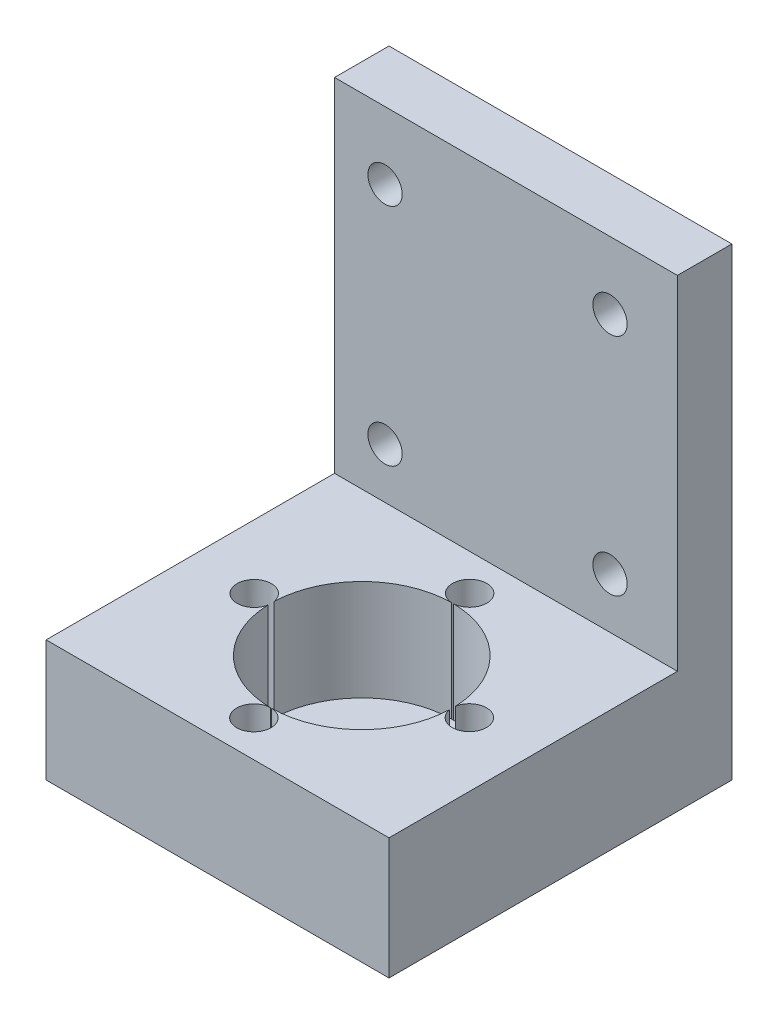
from build123d import *

# Parameters (mm, degrees)
SKETCH1_W           = 34
SKETCH1_H           = 34
BOSS_EXTRUDE1_DEPTH = 12.04
SKETCH2_W           = 34
SKETCH2_H           = 5.4
BOSS_EXTRUDE2_DEPTH = 34
SKETCH3_R           = 9
CUT_EXTRUDE1_DEPTH  = 10
SKETCH4_R           = 1.7
SKETCH4_R_2         = 1.700000029
CUT_EXTRUDE2_DEPTH  = 59.889727457
SKETCH6_R           = 3
CUT_EXTRUDE3_DEPTH  = 66.176682947
SKETCH7_R           = 1.7
CUT_EXTRUDE4_DEPTH  = 64.981572347


with BuildPart() as part:
    # Sketch1 → Boss-Extrude1 (new body)
    with BuildSketch(Plane(origin=(0, 0, 0), x_dir=(1, 0, 0), z_dir=(0, 1, 0))):
        with Locations((17, 17)):
            Rectangle(SKETCH1_W, SKETCH1_H)
    extrude(amount=BOSS_EXTRUDE1_DEPTH)

    # Sketch2 → Boss-Extrude2 (add)
    with BuildSketch(Plane(origin=(0, 12.04, 0), x_dir=(1, 0, 0), z_dir=(0, 1, 0))):
        with Locations((17, 31.3)):
            Rectangle(SKETCH2_W, SKETCH2_H)
    extrude(amount=BOSS_EXTRUDE2_DEPTH)

    # Sketch3 → Cut-Extrude1 (cut)
    with BuildSketch(Plane(origin=(0, 12.04, 0), x_dir=(1, 0, 0), z_dir=(0, 1, 0))):
        with Locations(Location((17, 14.3, 0), (0, 0, 270))):
            Circle(SKETCH3_R)
    extrude(amount=-CUT_EXTRUDE1_DEPTH, mode=Mode.SUBTRACT)

    # Sketch4 → Cut-Extrude2 (cut, through all)
    with BuildSketch(Plane(origin=(0, 12.04, 0), x_dir=(1, 0, 0), z_dir=(0, 1, 0))):
        with Locations(Location((6.33358771, 14.3, 0), (0, 0, 270))):
            Circle(SKETCH4_R)
        with Locations(Location((27.668868507, 14.3, 0), (0, 0, 270))):
            Circle(SKETCH4_R_2)
        with Locations(Location((17, 3.600864666, 0), (0, 0, 270))):
            Circle(SKETCH4_R)
        with Locations(Location((17, 24.997428292, 0), (0, 0, 270))):
            Circle(SKETCH4_R)
    extrude(amount=-CUT_EXTRUDE2_DEPTH, mode=Mode.SUBTRACT)

    # Sketch6 → Cut-Extrude3 (cut, through all)
    with BuildSketch(Plane(origin=(0, 2.04, 0), x_dir=(1, 0, 0), z_dir=(0, 1, 0))):
        with Locations(Location((17, 14.3, 0), (0, 0, 270))):
            Circle(SKETCH6_R)
    extrude(amount=-CUT_EXTRUDE3_DEPTH, mode=Mode.SUBTRACT)

    # Sketch7 → Cut-Extrude4 (cut, through all)
    with BuildSketch(Plane.XY.offset(-28.6)):
        with Locations((5.006682724, 39.357086706)):
            Circle(SKETCH7_R)
        with Locations((27.317086706, 39.357086706)):
            Circle(SKETCH7_R)
        with Locations((5.006682724, 17.046682724)):
            Circle(SKETCH7_R)
        with Locations((27.317086706, 17.046682724)):
            Circle(SKETCH7_R)
    extrude(amount=-CUT_EXTRUDE4_DEPTH, mode=Mode.SUBTRACT)


solid = part.part
